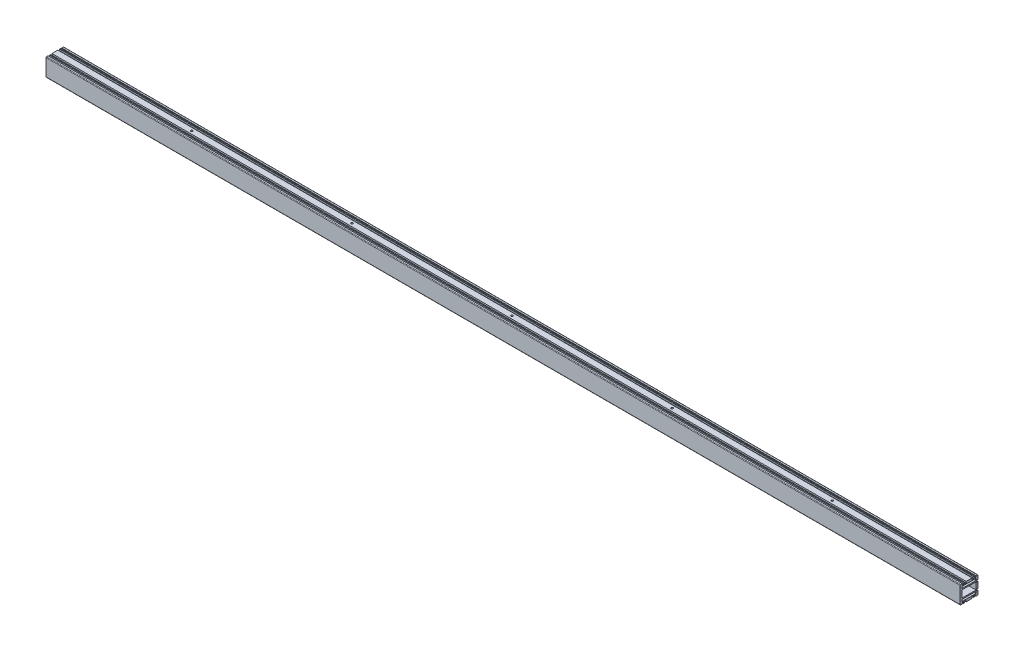
from build123d import *

# Parameters (mm, degrees)
SKETCH_1_W             = 23.5
SKETCH_1_H             = 12
EXTRUDE_1_DEPTH        = 771
HOLE_WIZARD_M6_1_D     = 5
HOLE_WIZARD_M6_1_DEPTH = 15
HOLE_WIZARD_M6_1_TIP   = 1.502151548
HOLE_WIZARD_M6_2_D     = 5
HOLE_WIZARD_M6_2_DEPTH = 15
HOLE_WIZARD_M6_2_TIP   = 1.502151548
HOLE_WIZARD_M4_1_D     = 3.3
HOLE_WIZARD_M4_1_DEPTH = 10.1
HOLE_WIZARD_M4_1_TIP   = 0.991420021
HOLE_WIZARD_M6_3_D     = 5
HOLE_WIZARD_M6_3_DEPTH = 15
HOLE_WIZARD_M6_3_TIP   = 1.502151548


with BuildPart() as part:
    # 草图1 → 凸台-拉伸1 (new, symmetric)
    with BuildSketch(Plane(origin=(0, 0, 0), x_dir=(0, 0, -1), z_dir=(1, 0, 0))):
        with BuildLine():
            Line((-14, 15), (-11.5, 15))
            Line((-11.5, 15), (-11.5, 13.5))
            Line((-11.5, 13.5), (-11.4, 13.5))
            ThreePointArc((-11.4, 13.5), (-11.117157288, 13.382842712), (-11, 13.1))
            Line((-11, 13.1), (-11, 12))
            Line((-11, 12), (-9.5, 12))
            Line((-9.5, 12), (-9.5, 15))
            Line((-9.5, 15), (-8, 15))
            Line((-8, 15), (-8, 12.5))
            Line((-8, 12.5), (-5, 12.5))
            Line((-5, 12.5), (-5, 15))
            Line((-5, 15), (5, 15))
            Line((5, 15), (5, 12.5))
            Line((5, 12.5), (8, 12.5))
            Line((8, 12.5), (8, 15))
            Line((8, 15), (9.5, 15))
            Line((9.5, 15), (9.5, 12))
            Line((9.5, 12), (11, 12))
            Line((11, 12), (11, 13.1))
            ThreePointArc((11, 13.1), (11.117157288, 13.382842712), (11.4, 13.5))
            Line((11.4, 13.5), (11.5, 13.5))
            Line((11.5, 13.5), (11.5, 15))
            Line((11.5, 15), (14, 15))
            ThreePointArc((14, 15), (14.707106781, 14.707106781), (15, 14))
            Line((15, 14), (15, 8))
            Line((15, 8), (12.5, 8))
            Line((12.5, 8), (12.5, 5))
            Line((12.5, 5), (15, 5))
            Line((15, 5), (15, -5))
            Line((15, -5), (12.5, -5))
            Line((12.5, -5), (12.5, -8))
            Line((12.5, -8), (15, -8))
            Line((15, -8), (15, -14))
            ThreePointArc((15, -14), (14.707106781, -14.707106781), (14, -15))
            Line((14, -15), (11.5, -15))
            Line((11.5, -15), (11.5, -13.5))
            Line((11.5, -13.5), (11.4, -13.5))
            ThreePointArc((11.4, -13.5), (11.117157288, -13.382842712), (11, -13.1))
            Line((11, -13.1), (11, -12))
            Line((11, -12), (9.5, -12))
            Line((9.5, -12), (9.5, -15))
            Line((9.5, -15), (8, -15))
            Line((8, -15), (8, -12.5))
            Line((8, -12.5), (5, -12.5))
            Line((5, -12.5), (5, -15))
            Line((5, -15), (-5, -15))
            Line((-5, -15), (-5, -12.5))
            Line((-5, -12.5), (-8, -12.5))
            Line((-8, -12.5), (-8, -15))
            Line((-8, -15), (-9.5, -15))
            Line((-9.5, -15), (-9.5, -12))
            Line((-9.5, -12), (-11, -12))
            Line((-11, -12), (-11, -13.1))
            ThreePointArc((-11, -13.1), (-11.117157288, -13.382842712), (-11.4, -13.5))
            Line((-11.4, -13.5), (-11.5, -13.5))
            Line((-11.5, -13.5), (-11.5, -15))
            Line((-11.5, -15), (-14, -15))
            ThreePointArc((-14, -15), (-14.707106781, -14.707106781), (-15, -14))
            Line((-15, -14), (-15, 14))
            ThreePointArc((-15, 14), (-14.707106781, 14.707106781), (-14, 15))
        make_face()
        with BuildLine():
            Line((12, -10.5), (12, -8.5))
            ThreePointArc((12, -8.5), (11.853553391, -8.146446609), (11.5, -8))
            Line((11.5, -8), (-11.5, -8))
            ThreePointArc((-11.5, -8), (-11.853553391, -8.146446609), (-12, -8.5))
            Line((-12, -8.5), (-12, -10.5))
            ThreePointArc((-12, -10.5), (-11.853553391, -10.853553391), (-11.5, -11))
            Line((-11.5, -11), (11.5, -11))
            ThreePointArc((11.5, -11), (11.853553391, -10.853553391), (12, -10.5))
        make_face(mode=Mode.SUBTRACT)
        with BuildLine():
            Line((-11.5, 11), (11.5, 11))
            ThreePointArc((11.5, 11), (11.853553391, 10.853553391), (12, 10.5))
            Line((12, 10.5), (12, 8.5))
            ThreePointArc((12, 8.5), (11.853553391, 8.146446609), (11.5, 8))
            Line((11.5, 8), (-11.5, 8))
            ThreePointArc((-11.5, 8), (-11.853553391, 8.146446609), (-12, 8.5))
            Line((-12, 8.5), (-12, 10.5))
            ThreePointArc((-12, 10.5), (-11.853553391, 10.853553391), (-11.5, 11))
        make_face(mode=Mode.SUBTRACT)
        Rectangle(SKETCH_1_W, SKETCH_1_H, mode=Mode.SUBTRACT)
    extrude(amount=EXTRUDE_1_DEPTH, both=True)

    # M6 螺纹孔1
    with Locations(Plane.XZ.offset(15)):
        with Locations((-751, 0), (-736, 0), (736, 0), (751, 0)):
            Hole(HOLE_WIZARD_M6_1_D / 2, depth=HOLE_WIZARD_M6_1_DEPTH)
            with Locations((0, 0, -(HOLE_WIZARD_M6_1_DEPTH + HOLE_WIZARD_M6_1_TIP / 2))):  # 118° drill point
                Cone(0, HOLE_WIZARD_M6_1_D / 2, HOLE_WIZARD_M6_1_TIP, mode=Mode.SUBTRACT)

    # M6 螺纹孔2
    with Locations(Plane(origin=(0, 0, -15), x_dir=(-1, 0, 0), z_dir=(0, 0, -1))):
        with Locations((-751, 0), (-736, 0), (736, 0), (751, 0)):
            Hole(HOLE_WIZARD_M6_2_D / 2, depth=HOLE_WIZARD_M6_2_DEPTH)
            with Locations((0, 0, -(HOLE_WIZARD_M6_2_DEPTH + HOLE_WIZARD_M6_2_TIP / 2))):  # 118° drill point
                Cone(0, HOLE_WIZARD_M6_2_D / 2, HOLE_WIZARD_M6_2_TIP, mode=Mode.SUBTRACT)

    # M4 螺纹孔1
    with Locations(Plane(origin=(0, 15, 0), x_dir=(-1, 0, 0), z_dir=(0, 1, 0))):
        with Locations((-540, 0), (-270, 0), (0, 0), (270, 0), (540, 0)):
            Hole(HOLE_WIZARD_M4_1_D / 2, depth=HOLE_WIZARD_M4_1_DEPTH)
            with Locations((0, 0, -(HOLE_WIZARD_M4_1_DEPTH + HOLE_WIZARD_M4_1_TIP / 2))):  # 118° drill point
                Cone(0, HOLE_WIZARD_M4_1_D / 2, HOLE_WIZARD_M4_1_TIP, mode=Mode.SUBTRACT)

    # M6 螺纹孔3
    with Locations(Plane(origin=(0, 0, -15), x_dir=(-1, 0, 0), z_dir=(0, 0, -1))):
        with Locations((321, 0), (261, 0), (-261, 0), (-321, 0)):
            Hole(HOLE_WIZARD_M6_3_D / 2, depth=HOLE_WIZARD_M6_3_DEPTH)
            with Locations((0, 0, -(HOLE_WIZARD_M6_3_DEPTH + HOLE_WIZARD_M6_3_TIP / 2))):  # 118° drill point
                Cone(0, HOLE_WIZARD_M6_3_D / 2, HOLE_WIZARD_M6_3_TIP, mode=Mode.SUBTRACT)


solid = part.part
